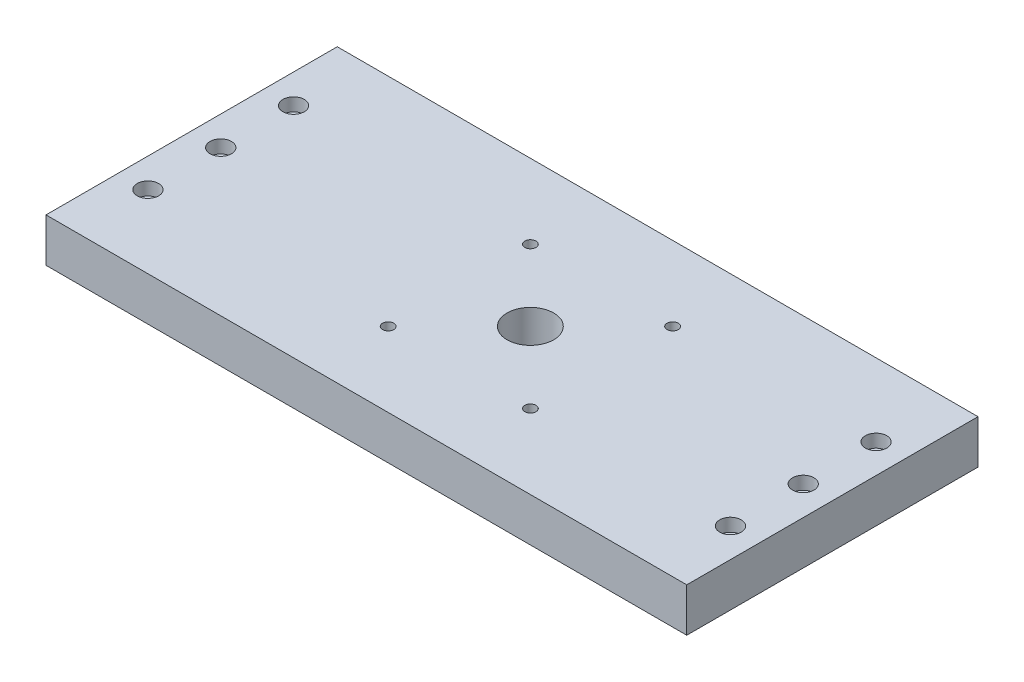
from build123d import *

# Parameters (mm, degrees)
SKETCH1_W           = 139.7
SKETCH1_H           = 63.5
BOSS_EXTRUDE1_DEPTH = 9.525
SKETCH2_R           = 1.2192
SKETCH2_R_2         = 5.08
CUT_EXTRUDE1_DEPTH  = 9.525
SKETCH3_R           = 2.3368
CUT_EXTRUDE3_DEPTH  = 2.8448
SKETCH4_R           = 1.2192
CUT_EXTRUDE5_DEPTH  = 154.750010163


with BuildPart() as part:
    # Sketch1 → Boss-Extrude1 (new body)
    with BuildSketch(Plane(origin=(0, 0, 0), x_dir=(1, 0, 0), z_dir=(0, 1, 0))):
        with Locations((69.85, 31.75)):
            Rectangle(SKETCH1_W, SKETCH1_H)
    extrude(amount=BOSS_EXTRUDE1_DEPTH)

    # Sketch2 → Cut-Extrude1 (cut)
    with BuildSketch(Plane(origin=(0, 9.525, 0), x_dir=(1, 0, 0), z_dir=(0, 1, 0))):
        with Locations(Location((58.34888, 47.2567, 0), (0, 0, 270))):
            Circle(SKETCH2_R)
        with Locations(Location((89.36228, 47.2567, 0), (0, 0, 270))):
            Circle(SKETCH2_R)
        with Locations(Location((89.36228, 16.2433, 0), (0, 0, 270))):
            Circle(SKETCH2_R)
        with Locations(Location((58.34888, 16.2433, 0), (0, 0, 270))):
            Circle(SKETCH2_R)
        with Locations(Location((73.85558, 31.75, 0), (0, 0, 270))):
            Circle(SKETCH2_R_2)
    extrude(amount=-CUT_EXTRUDE1_DEPTH, mode=Mode.SUBTRACT)

    # Sketch3 → Cut-Extrude3 (cut)
    with BuildSketch(Plane.XZ.offset(-9.525)):
        with Locations(Location((6.35, -15.875, 0), (0, 0, 270))):
            Circle(SKETCH3_R)
        with Locations(Location((6.35, -31.75, 0), (0, 0, 270))):
            Circle(SKETCH3_R)
        with Locations(Location((6.35, -47.625, 0), (0, 0, 270))):
            Circle(SKETCH3_R)
        with Locations(Location((133.35, -47.625, 0), (0, 0, 270))):
            Circle(SKETCH3_R)
        with Locations(Location((133.35, -31.75, 0), (0, 0, 270))):
            Circle(SKETCH3_R)
        with Locations(Location((133.35, -15.875, 0), (0, 0, 270))):
            Circle(SKETCH3_R)
    extrude(amount=CUT_EXTRUDE3_DEPTH, mode=Mode.SUBTRACT)

    # Sketch4 → Cut-Extrude5 (cut, through all)
    with BuildSketch(Plane(origin=(0, 9.525, 0), x_dir=(1, 0, 0), z_dir=(0, 1, 0))):
        with Locations(Location((6.35, 47.625, 0), (0, 0, 270))):
            Circle(SKETCH4_R)
        with Locations(Location((6.35, 31.75, 0), (0, 0, 270))):
            Circle(SKETCH4_R)
        with Locations(Location((6.35, 15.875, 0), (0, 0, 270))):
            Circle(SKETCH4_R)
        with Locations(Location((133.35, 15.875, 0), (0, 0, 270))):
            Circle(SKETCH4_R)
        with Locations(Location((133.35, 31.75, 0), (0, 0, 270))):
            Circle(SKETCH4_R)
        with Locations(Location((133.35, 47.625, 0), (0, 0, 270))):
            Circle(SKETCH4_R)
    extrude(amount=-CUT_EXTRUDE5_DEPTH, mode=Mode.SUBTRACT)


solid = part.part
